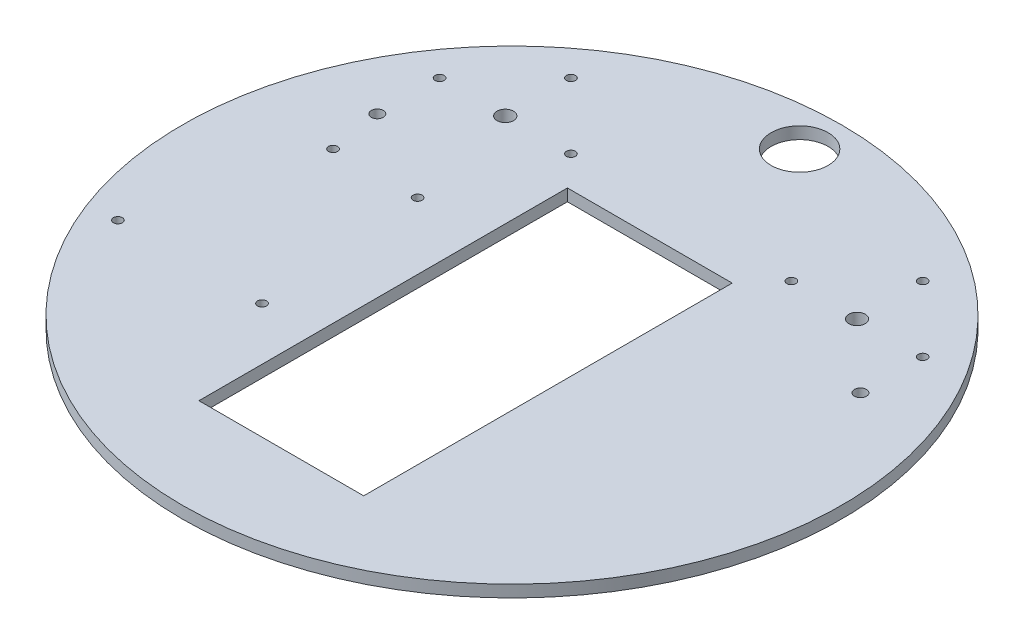
from build123d import *

# Parameters (mm, degrees)
SKETCH1_R                        = 9.5
SKETCH1_W                        = 55
SKETCH1_H                        = 123
FOND_DEPTH                       = 4
TROUS_STEPPERS_REACH             = 157.615
SKETCH5_R                        = 1.5
SKETCH5_R_2                      = 2.75
TROUS_STEPPERS_DIRECTION_2_DEPTH = 156.614909311
TROUS_POULIES_REACH              = 157.615
SKETCH7_R                        = 2
TROUS_CARTE_REACH                = 157.615
SKETCH9_R                        = 1.5


with BuildPart() as part:
    # Sketch1 → fond (new body)
    with BuildSketch(Plane(origin=(0, 0, 0), x_dir=(1, 0, 0), z_dir=(0, 1, 0))):
        with BuildLine():
            ThreePointArc((-110, 0), (0, 110), (110, 0))
            ThreePointArc((110, 0), (90.069417673, -63.146654702), (37.5, -103.4105894))
            ThreePointArc((37.5, -103.4105894), (0, -110), (-37.5, -103.4105894))
            ThreePointArc((-37.5, -103.4105894), (-90.069417673, -63.146654702), (-110, 0))
        make_face()
        with Locations(Location((0, 96, 0), (0, 0, 270))):
            Circle(SKETCH1_R, mode=Mode.SUBTRACT)
        with Locations((0, -15.5)):
            Rectangle(SKETCH1_W, SKETCH1_H, mode=Mode.SUBTRACT)
    extrude(amount=FOND_DEPTH)

    # Sketch5 → trous steppers (cut, up to next)
    with BuildSketch(Plane(origin=(0, 4, 0), x_dir=(1, 0, 0), z_dir=(0, 1, 0)), mode=Mode.PRIVATE) as trous_steppers_sk1:
        with Locations(Location((36.787473029, 56.456130336, 0), (0, 0, 90))):
            Circle(SKETCH5_R)
    trous_steppers_tool1 = extrude(trous_steppers_sk1.sketch, amount=-TROUS_STEPPERS_REACH, mode=Mode.PRIVATE) & part.part
    # Sketch5 → trous steppers (cut, up to next)
    with BuildSketch(Plane(origin=(0, 4, 0), x_dir=(1, 0, 0), z_dir=(0, 1, 0)), mode=Mode.PRIVATE) as trous_steppers_sk2:
        with Locations(Location((58.707783245, 78.376440552, 0), (0, 0, 90))):
            Circle(SKETCH5_R)
    trous_steppers_tool2 = extrude(trous_steppers_sk2.sketch, amount=-TROUS_STEPPERS_REACH, mode=Mode.PRIVATE) & part.part
    # Sketch5 → trous steppers (cut, up to next)
    with BuildSketch(Plane(origin=(0, 4, 0), x_dir=(1, 0, 0), z_dir=(0, 1, 0)), mode=Mode.PRIVATE) as trous_steppers_sk3:
        with Locations(Location((80.628093462, 56.456130336, 0), (0, 0, 90))):
            Circle(SKETCH5_R)
    trous_steppers_tool3 = extrude(trous_steppers_sk3.sketch, amount=-TROUS_STEPPERS_REACH, mode=Mode.PRIVATE) & part.part
    # Sketch5 → trous steppers (cut, up to next)
    with BuildSketch(Plane(origin=(0, 4, 0), x_dir=(1, 0, 0), z_dir=(0, 1, 0)), mode=Mode.PRIVATE) as trous_steppers_sk4:
        with Locations(Location((-80.628093462, 56.456130336, 0), (0, 0, 90))):
            Circle(SKETCH5_R)
    trous_steppers_tool4 = extrude(trous_steppers_sk4.sketch, amount=-TROUS_STEPPERS_REACH, mode=Mode.PRIVATE) & part.part
    # Sketch5 → trous steppers (cut, up to next)
    with BuildSketch(Plane(origin=(0, 4, 0), x_dir=(1, 0, 0), z_dir=(0, 1, 0)), mode=Mode.PRIVATE) as trous_steppers_sk5:
        with Locations(Location((-58.707783245, 78.376440552, 0), (0, 0, 90))):
            Circle(SKETCH5_R)
    trous_steppers_tool5 = extrude(trous_steppers_sk5.sketch, amount=-TROUS_STEPPERS_REACH, mode=Mode.PRIVATE) & part.part
    # Sketch5 → trous steppers (cut, up to next)
    with BuildSketch(Plane(origin=(0, 4, 0), x_dir=(1, 0, 0), z_dir=(0, 1, 0)), mode=Mode.PRIVATE) as trous_steppers_sk6:
        with Locations(Location((-36.787473029, 56.456130336, 0), (0, 0, 90))):
            Circle(SKETCH5_R)
    trous_steppers_tool6 = extrude(trous_steppers_sk6.sketch, amount=-TROUS_STEPPERS_REACH, mode=Mode.PRIVATE) & part.part
    # Sketch5 → trous steppers (cut, up to next)
    with BuildSketch(Plane(origin=(0, 4, 0), x_dir=(1, 0, 0), z_dir=(0, 1, 0)), mode=Mode.PRIVATE) as trous_steppers_sk7:
        with Locations(Location((58.707783245, 56.456130336, 0), (0, 0, 90))):
            Circle(SKETCH5_R_2)
    trous_steppers_tool7 = extrude(trous_steppers_sk7.sketch, amount=-TROUS_STEPPERS_REACH, mode=Mode.PRIVATE) & part.part
    # Sketch5 → trous steppers (cut, up to next)
    with BuildSketch(Plane(origin=(0, 4, 0), x_dir=(1, 0, 0), z_dir=(0, 1, 0)), mode=Mode.PRIVATE) as trous_steppers_sk8:
        with Locations(Location((-58.707783245, 56.456130336, 0), (0, 0, 90))):
            Circle(SKETCH5_R_2)
    trous_steppers_tool8 = extrude(trous_steppers_sk8.sketch, amount=-TROUS_STEPPERS_REACH, mode=Mode.PRIVATE) & part.part
    add(trous_steppers_tool1.solids().sort_by_distance((36.787473, 4, -56.45613))[0], mode=Mode.SUBTRACT)
    add(trous_steppers_tool2.solids().sort_by_distance((58.707783, 4, -78.376441))[0], mode=Mode.SUBTRACT)
    add(trous_steppers_tool3.solids().sort_by_distance((80.628093, 4, -56.45613))[0], mode=Mode.SUBTRACT)
    add(trous_steppers_tool4.solids().sort_by_distance((-80.628093, 4, -56.45613))[0], mode=Mode.SUBTRACT)
    add(trous_steppers_tool5.solids().sort_by_distance((-58.707783, 4, -78.376441))[0], mode=Mode.SUBTRACT)
    add(trous_steppers_tool6.solids().sort_by_distance((-36.787473, 4, -56.45613))[0], mode=Mode.SUBTRACT)
    add(trous_steppers_tool7.solids().sort_by_distance((58.707783, 4, -56.45613))[0], mode=Mode.SUBTRACT)
    add(trous_steppers_tool8.solids().sort_by_distance((-58.707783, 4, -56.45613))[0], mode=Mode.SUBTRACT)

    # Sketch5 → trous steppers direction 2 (cut)
    with BuildSketch(Plane(origin=(0, 4, 0), x_dir=(1, 0, 0), z_dir=(0, 1, 0))):
        with Locations(Location((36.787473029, 56.456130336, 0), (0, 0, 90))):
            Circle(SKETCH5_R)
        with Locations(Location((58.707783245, 78.376440552, 0), (0, 0, 90))):
            Circle(SKETCH5_R)
        with Locations(Location((80.628093462, 56.456130336, 0), (0, 0, 90))):
            Circle(SKETCH5_R)
        with Locations(Location((-80.628093462, 56.456130336, 0), (0, 0, 90))):
            Circle(SKETCH5_R)
        with Locations(Location((-58.707783245, 78.376440552, 0), (0, 0, 90))):
            Circle(SKETCH5_R)
        with Locations(Location((-36.787473029, 56.456130336, 0), (0, 0, 90))):
            Circle(SKETCH5_R)
        with Locations(Location((58.707783245, 56.456130336, 0), (0, 0, 90))):
            Circle(SKETCH5_R_2)
        with Locations(Location((-58.707783245, 56.456130336, 0), (0, 0, 90))):
            Circle(SKETCH5_R_2)
    extrude(amount=TROUS_STEPPERS_DIRECTION_2_DEPTH, mode=Mode.SUBTRACT)

    # Sketch7 → trous poulies (cut, up to next)
    with BuildSketch(Plane(origin=(0, 4, 0), x_dir=(1, 0, 0), z_dir=(0, 1, 0)), mode=Mode.PRIVATE) as trous_poulies_sk1:
        with Locations(Location((80.628093462, 35.675463443, 0), (0, 0, 270))):
            Circle(SKETCH7_R)
    trous_poulies_tool1 = extrude(trous_poulies_sk1.sketch, amount=-TROUS_POULIES_REACH, mode=Mode.PRIVATE) & part.part
    # Sketch7 → trous poulies (cut, up to next)
    with BuildSketch(Plane(origin=(0, 4, 0), x_dir=(1, 0, 0), z_dir=(0, 1, 0)), mode=Mode.PRIVATE) as trous_poulies_sk2:
        with Locations(Location((-80.628093462, 35.675463443, 0), (0, 0, 90))):
            Circle(SKETCH7_R)
    trous_poulies_tool2 = extrude(trous_poulies_sk2.sketch, amount=-TROUS_POULIES_REACH, mode=Mode.PRIVATE) & part.part
    add(trous_poulies_tool1.solids().sort_by_distance((80.628093, 4, -35.675463))[0], mode=Mode.SUBTRACT)
    add(trous_poulies_tool2.solids().sort_by_distance((-80.628093, 4, -35.675463))[0], mode=Mode.SUBTRACT)

    # Sketch9 → trous carte (cut, up to next)
    with BuildSketch(Plane(origin=(0, 4, 0), x_dir=(1, 0, 0), z_dir=(0, 1, 0)), mode=Mode.PRIVATE) as trous_carte_sk1:
        with Locations(Location((-49.687242847, 18.164395088, 0), (0, 0, 270))):
            Circle(SKETCH9_R)
    trous_carte_tool1 = extrude(trous_carte_sk1.sketch, amount=-TROUS_CARTE_REACH, mode=Mode.PRIVATE) & part.part
    # Sketch9 → trous carte (cut, up to next)
    with BuildSketch(Plane(origin=(0, 4, 0), x_dir=(1, 0, 0), z_dir=(0, 1, 0)), mode=Mode.PRIVATE) as trous_carte_sk2:
        with Locations(Location((-77.887242847, 18.164395088, 0), (0, 0, 270))):
            Circle(SKETCH9_R)
    trous_carte_tool2 = extrude(trous_carte_sk2.sketch, amount=-TROUS_CARTE_REACH, mode=Mode.PRIVATE) & part.part
    # Sketch9 → trous carte (cut, up to next)
    with BuildSketch(Plane(origin=(0, 4, 0), x_dir=(1, 0, 0), z_dir=(0, 1, 0)), mode=Mode.PRIVATE) as trous_carte_sk3:
        with Locations(Location((-93.187242847, -38.350487124, 0), (0, 0, 270))):
            Circle(SKETCH9_R)
    trous_carte_tool3 = extrude(trous_carte_sk3.sketch, amount=-TROUS_CARTE_REACH, mode=Mode.PRIVATE) & part.part
    # Sketch9 → trous carte (cut, up to next)
    with BuildSketch(Plane(origin=(0, 4, 0), x_dir=(1, 0, 0), z_dir=(0, 1, 0)), mode=Mode.PRIVATE) as trous_carte_sk4:
        with Locations(Location((-45.087242847, -38.350487124, 0), (0, 0, 270))):
            Circle(SKETCH9_R)
    trous_carte_tool4 = extrude(trous_carte_sk4.sketch, amount=-TROUS_CARTE_REACH, mode=Mode.PRIVATE) & part.part
    add(trous_carte_tool1.solids().sort_by_distance((-49.687243, 4, -18.164395))[0], mode=Mode.SUBTRACT)
    add(trous_carte_tool2.solids().sort_by_distance((-77.887243, 4, -18.164395))[0], mode=Mode.SUBTRACT)
    add(trous_carte_tool3.solids().sort_by_distance((-93.187243, 4, 38.350487))[0], mode=Mode.SUBTRACT)
    add(trous_carte_tool4.solids().sort_by_distance((-45.087243, 4, 38.350487))[0], mode=Mode.SUBTRACT)


solid = part.part
